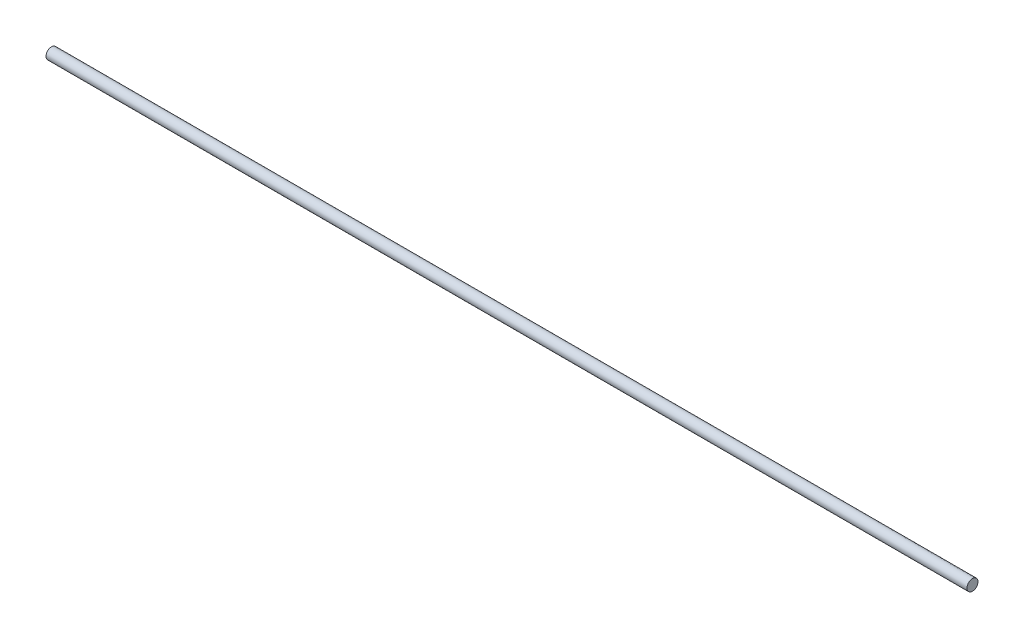
from build123d import *

# Parameters (mm, degrees)
SKETCH1_R           = 1.5
BOSS_EXTRUDE1_DEPTH = 250


with BuildPart() as part:
    # Sketch1 → Boss-Extrude1 (new body)
    with BuildSketch(Plane(origin=(0, 0, 0), x_dir=(0, 0, -1), z_dir=(1, 0, 0))):
        Circle(SKETCH1_R)
    extrude(amount=BOSS_EXTRUDE1_DEPTH)


solid = part.part
